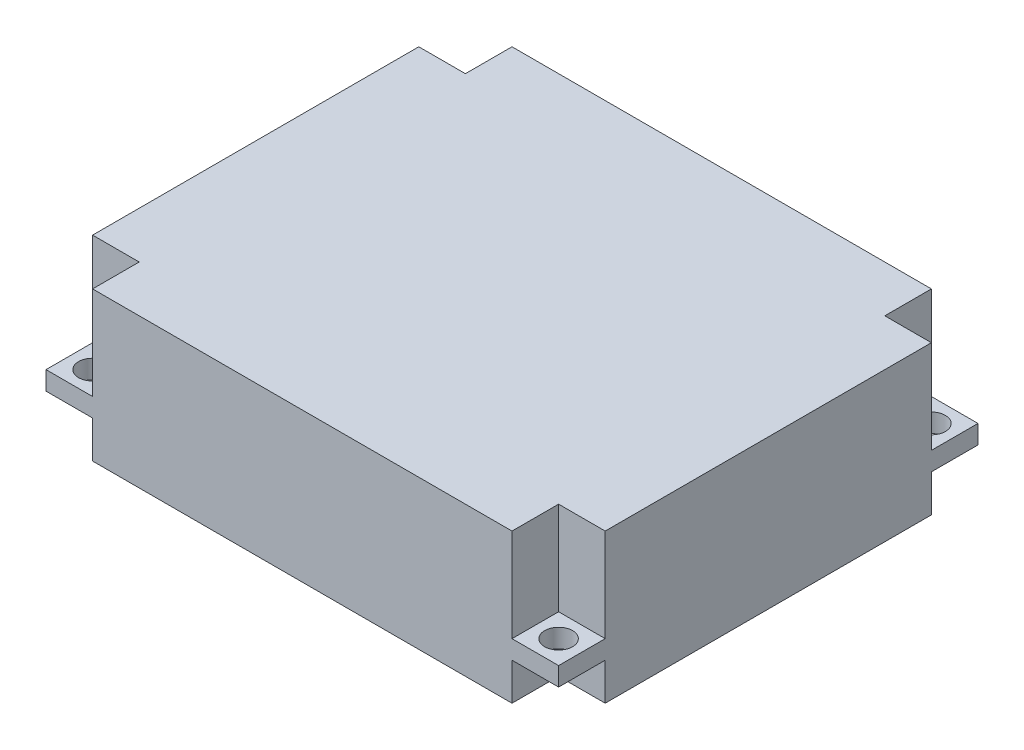
from build123d import *

# Parameters (mm, degrees)
SKETCH_1_W                 = 55
SKETCH_1_H                 = 45
EXTRUDE_360_DEPTH          = 2
CUT_EXTRUDE_614_DEPTH      = 36.587919299
CUT_EXTRUDE_614_DEPTH_BACK = 36.587919299
SKETCH_2_R                 = 1.5
EXTRUDE_883_DEPTH          = 10
EXTRUDE_883_DEPTH_BACK     = 6


with BuildPart() as part:
    # Эскиз1 → Extrude 360 (new body)
    with BuildSketch(Plane(origin=(0, 0, 0), x_dir=(1, 0, 0), z_dir=(0, 1, 0))):
        Rectangle(SKETCH_1_W, SKETCH_1_H)
    extrude(amount=EXTRUDE_360_DEPTH)

    # Эскиз2 → Cut-Extrude 614 (cut, two sides: drawn at the far end of the back side and taken through both)
    with BuildSketch(Plane(origin=(0, 2, 0), x_dir=(1, 0, 0), z_dir=(0, 1, 0)).offset(-CUT_EXTRUDE_614_DEPTH_BACK)):
        with Locations(Location((-25, 20, 0), (0, 0, 270))):
            Circle(SKETCH_2_R)
        with Locations(Location((25, 20, 0), (0, 0, 270))):
            Circle(SKETCH_2_R)
        with Locations(Location((25, -20, 0), (0, 0, 270))):
            Circle(SKETCH_2_R)
        with Locations(Location((-25, -20, 0), (0, 0, 270))):
            Circle(SKETCH_2_R)
    extrude(amount=CUT_EXTRUDE_614_DEPTH + CUT_EXTRUDE_614_DEPTH_BACK, mode=Mode.SUBTRACT)

    # Эскиз3 → Extrude 883 (add, two sides: drawn at the far end of the back side and taken through both)
    with BuildSketch(Plane(origin=(0, 2, 0), x_dir=(1, 0, 0), z_dir=(0, 1, 0)).offset(-EXTRUDE_883_DEPTH_BACK)):
        Polygon((-27.5, 17.5), (-22.5, 17.5), (-22.5, 22.5), (22.5, 22.5), (22.5, 17.5), (27.5, 17.5), (27.5, -17.5), (22.5, -17.5), (22.5, -22.5), (-22.5, -22.5), (-22.5, -17.5), (-27.5, -17.5), align=None)
    extrude(amount=EXTRUDE_883_DEPTH + EXTRUDE_883_DEPTH_BACK)


solid = part.part
